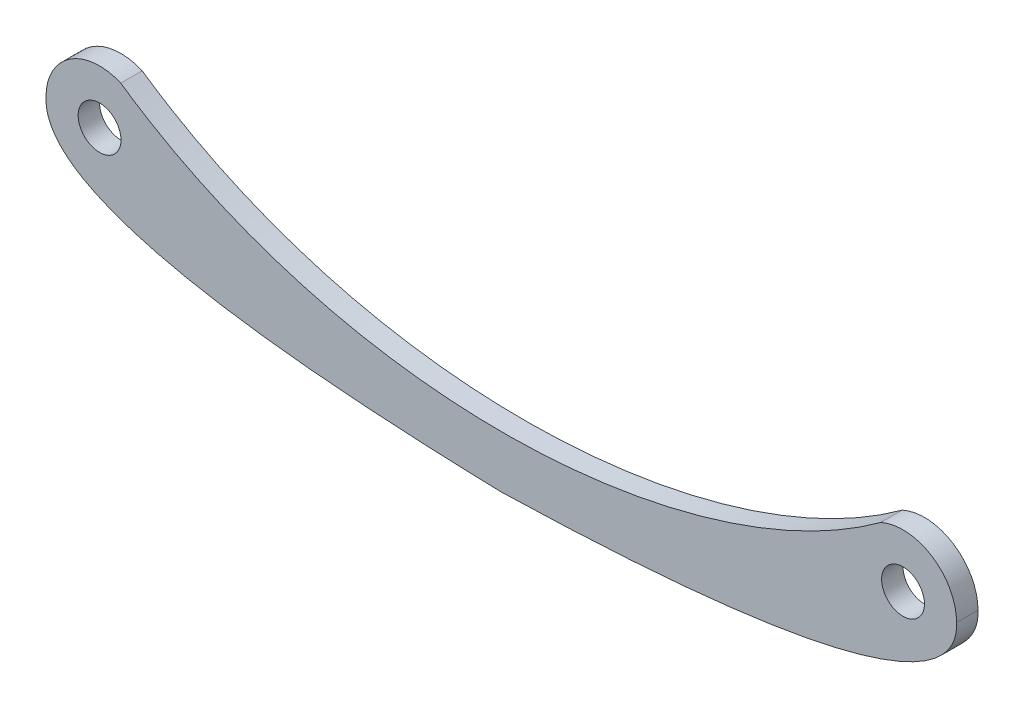
from build123d import *

# Parameters (mm, degrees)
SKETCH_1_R      = 4
EXTRUDE_1_DEPTH = 4


with BuildPart() as part:
    # 草图1 → 凸台-拉伸1 (new body)
    with BuildSketch(Plane.XY):
        with BuildLine():
            ThreePointArc((3.948047826, 9.187650318), (-5.50088728, 8.351062156), (-10, 0))
            add(Edge.make_bspline(
                [(-10, 0), (-10.890214237, -19.135341361), (75, -21.401956932)],
                knots=[0, 0, 0, 1, 1, 1], degree=2))
            add(Edge.make_bspline(
                [(160, 0), (160.890214237, -19.135341361), (75, -21.401956932)],
                knots=[0, 0, 0, 1, 1, 1], degree=2))
            ThreePointArc((160, 0), (155.415713455, 8.40654791), (145.865990446, 9.105490926))
            add(Edge.make_bspline(
                [(3.948047826, 9.187650318), (46.906488456, -20.373746255), (110.551742639, -16.70704022), (145.865990446, 9.105490926)],
                knots=[0.022448948, 0.022448948, 0.022448948, 0.022448948, 0.850781246, 0.850781246, 0.850781246, 0.850781246], degree=3))
        make_face()
        Circle(SKETCH_1_R, mode=Mode.SUBTRACT)
        with Locations((150, 0)):
            Circle(SKETCH_1_R, mode=Mode.SUBTRACT)
    extrude(amount=EXTRUDE_1_DEPTH)


solid = part.part
